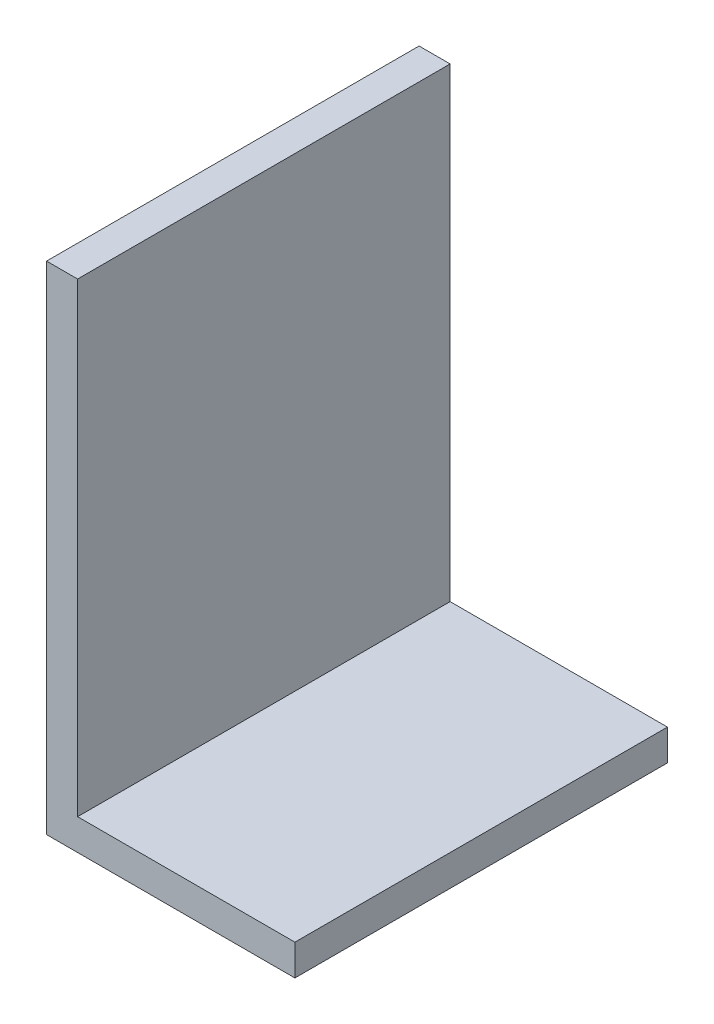
from build123d import *

# Parameters (mm, degrees)
BOSS_EXTRUDE1_DEPTH = 38.1


with BuildPart() as part:
    # Sketch1 → Boss-Extrude1 (new body)
    with BuildSketch(Plane.XY):
        Polygon((-9.525, -22.225), (12.7, -22.225), (12.7, -25.4), (-12.7, -25.4), (-12.7, 25.4), (-9.525, 25.4), align=None)
    extrude(amount=BOSS_EXTRUDE1_DEPTH)


solid = part.part
